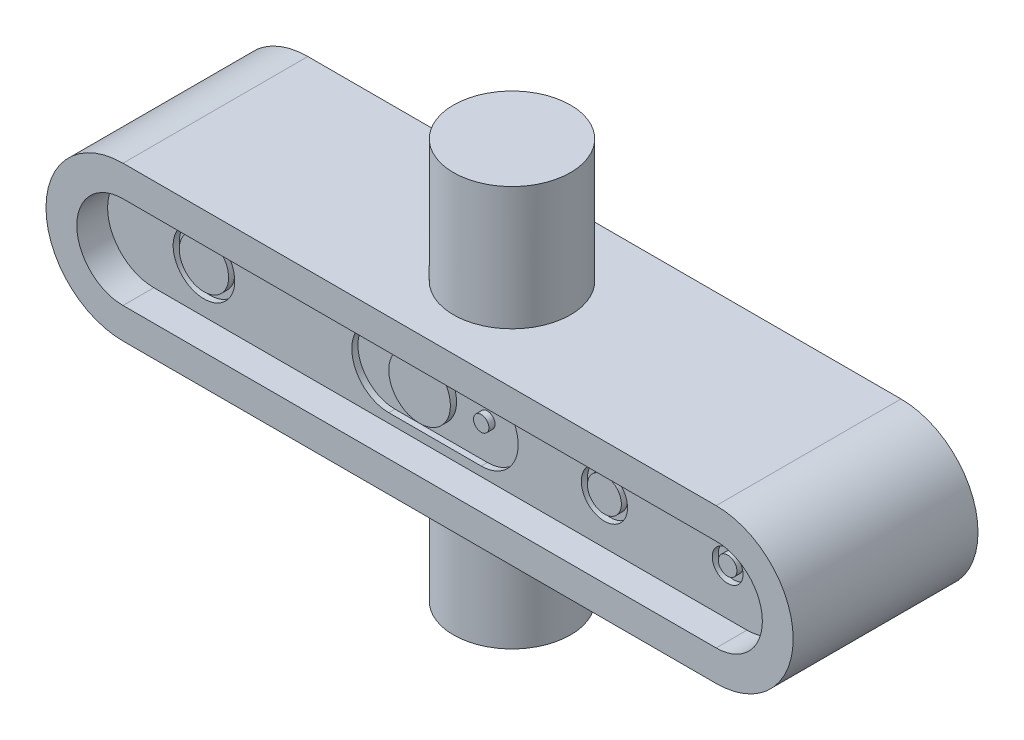
from build123d import *

# Parameters (mm, degrees)
BOSS_EXTRUDE1_DEPTH = 25
EXTRUDE_THIN2_DEPTH = 5
SKETCH3_R           = 5
SKETCH3_R_2         = 3.75
SKETCH3_R_3         = 2.5
CUT_EXTRUDE1_DEPTH  = 1
SKETCH4_R           = 5
SKETCH4_R_2         = 1.25
SKETCH4_R_3         = 4
SKETCH4_R_4         = 2.75
SKETCH4_R_5         = 1.5
BOSS_EXTRUDE2_DEPTH = 1
SKETCH5_R           = 9.5
BOSS_EXTRUDE4_DEPTH = 20
BOSS_EXTRUDE5_START = 20
SKETCH7_R           = 9.5
BOSS_EXTRUDE5_DEPTH = 20


with BuildPart() as part:
    # Sketch1 → Boss-Extrude1 (new body)
    with BuildSketch(Plane.XY):
        with BuildLine():
            Line((-48.13609402, 12.5), (48.13609402, 12.5))
            ThreePointArc((48.13609402, 12.5), (60.63609402, 0), (48.13609402, -12.5))
            Line((48.13609402, -12.5), (-48.13609402, -12.5))
            ThreePointArc((-48.13609402, -12.5), (-60.63609402, 0), (-48.13609402, 12.5))
        make_face()
    extrude(amount=BOSS_EXTRUDE1_DEPTH)

    # Sketch2 → Extrude-Thin2 (add)
    with BuildSketch(Plane.XY.offset(25)):
        with BuildLine():
            Line((48.13609402, -12.5), (-48.13609402, -12.5))
            ThreePointArc((-48.13609402, -12.5), (-60.63609402, 0), (-48.13609402, 12.5))
            Line((-48.13609402, 12.5), (48.13609402, 12.5))
            ThreePointArc((48.13609402, 12.5), (60.63609402, 0), (48.13609402, -12.5))
        make_face()
        with BuildLine():
            Line((48.13609402, -7.5), (-48.13609402, -7.5))
            ThreePointArc((-48.13609402, -7.5), (-55.63609402, 0), (-48.13609402, 7.5))
            Line((-48.13609402, 7.5), (48.13609402, 7.5))
            ThreePointArc((48.13609402, 7.5), (55.63609402, 0), (48.13609402, -7.5))
        make_face(mode=Mode.SUBTRACT)
    extrude(amount=EXTRUDE_THIN2_DEPTH)

    # Sketch3 → Cut-Extrude1 (cut)
    with BuildSketch(Plane.XY.offset(25)):
        with Locations((-40, 0)):
            Circle(SKETCH3_R)
        with Locations((25, 0)):
            Circle(SKETCH3_R_2)
        with Locations((45, 0)):
            Circle(SKETCH3_R_3)
        with BuildLine():
            Line((-10, 6), (5, 6))
            ThreePointArc((5, 6), (11, 0), (5, -6))
            Line((5, -6), (-10, -6))
            ThreePointArc((-10, -6), (-16, 0), (-10, 6))
        make_face()
    extrude(amount=-CUT_EXTRUDE1_DEPTH, mode=Mode.SUBTRACT)

    # Sketch4 → Boss-Extrude2 (add)
    with BuildSketch(Plane.XY.offset(24)):
        with Locations((-5, 0)):
            Circle(SKETCH4_R)
        with Locations((5, 0)):
            Circle(SKETCH4_R_2)
        with Locations((-40, 0)):
            Circle(SKETCH4_R_3)
        with Locations((25, 0)):
            Circle(SKETCH4_R_4)
        with Locations((45, 0)):
            Circle(SKETCH4_R_5)
    extrude(amount=BOSS_EXTRUDE2_DEPTH)

    # Sketch5 → Boss-Extrude4 (add)
    with BuildSketch(Plane(origin=(0, 12.5, 0), x_dir=(1, 0, 0), z_dir=(0, 1, 0))):
        with Locations(Location((0, -15, 0), (0, 0, 90))):
            Circle(SKETCH5_R)
    extrude(amount=BOSS_EXTRUDE4_DEPTH)

    # Sketch7 → Boss-Extrude5 (add)
    with BuildSketch(Plane.XZ.offset(12.5).offset(BOSS_EXTRUDE5_START)):
        with Locations(Location((0, 15, 0), (0, 0, 270))):
            Circle(SKETCH7_R)
    extrude(amount=-BOSS_EXTRUDE5_DEPTH)


solid = part.part
